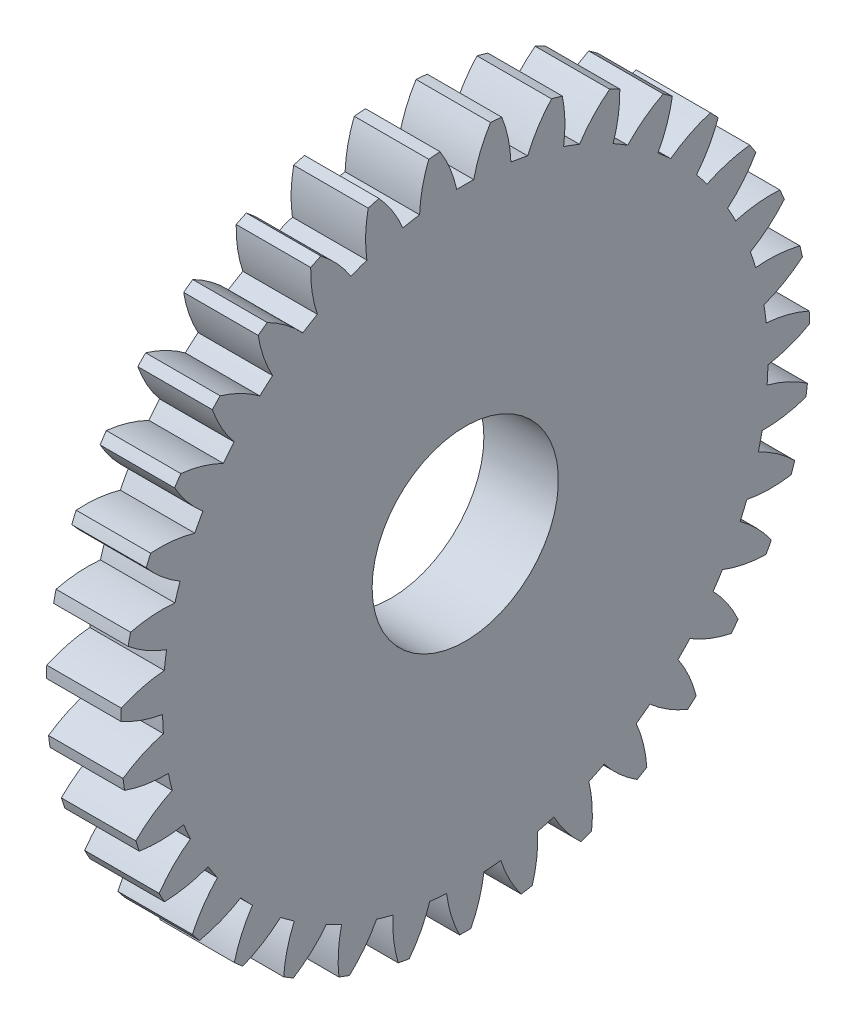
from build123d import *

# Parameters (mm, degrees)
BASPROSKE_W     = 4
BASPROSKE_H     = 18.5
TOOTHCUT_DEPTH  = 27.466960536
TEETHCUTS_COUNT = 35
TEETHCUTS_ANGLE = 349.714285714
BORSKE_R        = 5
BORE_DEPTH      = 50.0000508


with BuildPart() as part:
    # BasProSke → Base-Revolve (revolve)
    with BuildSketch(Plane(origin=(0, 0, 0), x_dir=(1, 0, 0), z_dir=(0, 1, 0)), mode=Mode.PRIVATE) as base_revolve_sk:
        with Locations((2, 9.25)):
            Rectangle(BASPROSKE_W, BASPROSKE_H)
    revolve(base_revolve_sk.sketch.rotate(Axis((-10, 0, 0), (1, 0, 0)), 180), axis=Axis((-10, 0, 0), (1, 0, 0)))

    # TooCutSke → ToothCut (cut, through all)
    with BuildSketch(Plane(origin=(0, 0, 0), x_dir=(0, 0, -1), z_dir=(1, 0, 0))):
        with BuildLine():
            ThreePointArc((0.456361119, 16.242590173), (0, 16.249), (-0.456361119, 16.242590173))
            ThreePointArc((-0.456361119, 16.242590173), (-0.817781123, 17.39831105), (-1.372969849, 18.474452602))
            ThreePointArc((-1.372969849, 18.474452602), (0, 18.5254), (1.372969849, 18.474452602))
            ThreePointArc((1.372969849, 18.474452602), (0.817781123, 17.39831105), (0.456361119, 16.242590173))
        make_face()
    toothcut = extrude(amount=TOOTHCUT_DEPTH, mode=Mode.SUBTRACT)

    # TeethCuts: ToothCut ×35 about axis
    teethcuts_axis = Axis((-10, 0, 0), (1, 0, 0))
    for i in range(1, TEETHCUTS_COUNT):
        add(toothcut.rotate(teethcuts_axis, i * TEETHCUTS_ANGLE / (TEETHCUTS_COUNT - 1)), mode=Mode.SUBTRACT)

    # BorSke → Bore (cut, symmetric)
    with BuildSketch(Plane(origin=(0, 0, 0), x_dir=(0, 0, -1), z_dir=(1, 0, 0))):
        with Locations(Location((0, 0, 0), (0, 0, 180))):
            Circle(BORSKE_R)
    extrude(amount=BORE_DEPTH, both=True, mode=Mode.SUBTRACT)


solid = part.part
